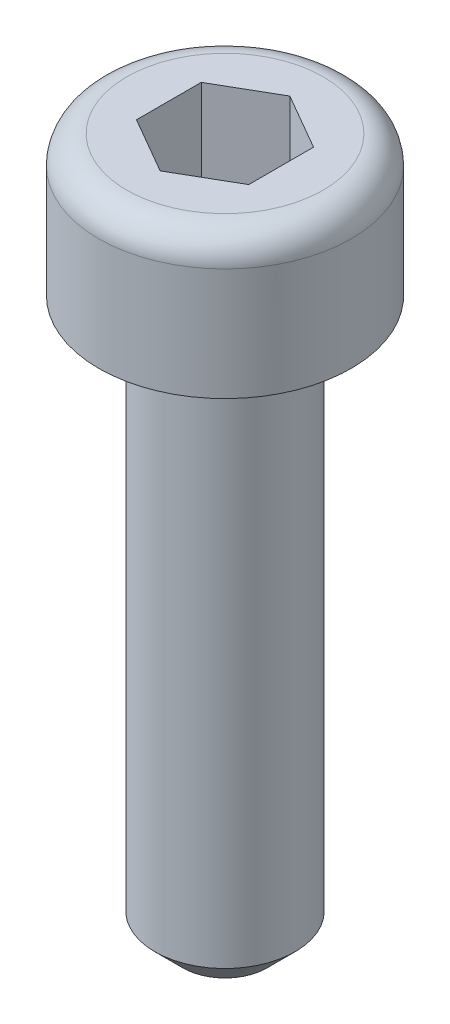
from build123d import *

# Parameters (mm, degrees)
CORTAR_EXTRUIR1_DEPTH = 2
CHAFL_N1_SIZE         = 0.5
REDONDEO1_R           = 0.5


with BuildPart() as part:
    # Croquis1 → Revolución1 (revolve)
    with BuildSketch(Plane.XY, mode=Mode.PRIVATE) as revoluci_n1_sk:
        Polygon((0, 0), (2.25, 0), (2.25, -2.5), (1.25, -2.5), (1.25, -12.5), (0, -12.5), align=None)
    revolve(revoluci_n1_sk.sketch.rotate(Axis((0, 0, 0), (0, -1, 0)), 90), axis=Axis((0, 0, 0), (0, -1, 0)))

    # Croquis2 → Cortar-Extruir1 (cut)
    with BuildSketch(Plane(origin=(0, 0, 0), x_dir=(1, 0, 0), z_dir=(0, 1, 0))):
        Polygon((1, 0.577350269), (0, 1.154700538), (-1, 0.577350269), (-1, -0.577350269), (0, -1.154700538), (1, -0.577350269), align=None)
    extrude(amount=-CORTAR_EXTRUIR1_DEPTH, mode=Mode.SUBTRACT)

    # Chaflán1
    chafl_n1_edges = [part.edges().sort_by_distance(p)[0] for p in [
        (0, -12.5, -1.25),
    ]]
    chamfer(chafl_n1_edges, length=CHAFL_N1_SIZE)

    # Redondeo1
    redondeo1_edges = [part.edges().sort_by_distance(p)[0] for p in [
        (0, 0, -2.25),
    ]]
    fillet(redondeo1_edges, radius=REDONDEO1_R)


solid = part.part
